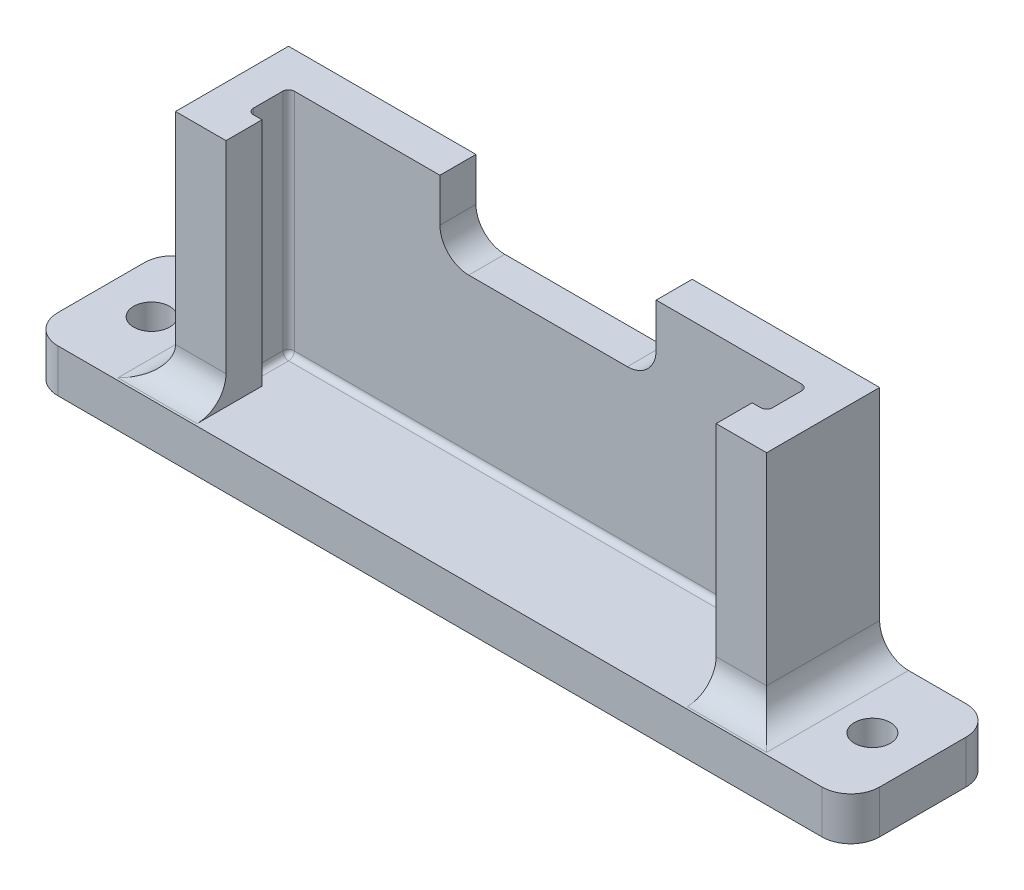
from build123d import *

# Parameters (mm, degrees)
BOSS_EXTRUDE1_DEPTH = 10.16
SKETCH3_W           = 19.05
SKETCH3_H           = 6.35
CUT_EXTRUDE1_DEPTH  = 19.05
SKETCH4_W           = 72.39
SKETCH4_H           = 12.7
BOSS_EXTRUDE2_DEPTH = 3.81
SKETCH5_R           = 1.5875
CUT_EXTRUDE2_DEPTH  = 43.059163523
FILLET1_R           = 2.54
FILLET2_R           = 0.508
FILLET3_R           = 2.54
FILLET4_R           = 2.54


with BuildPart() as part:
    # Sketch2 → Boss-Extrude1 (new, symmetric)
    with BuildSketch(Plane(origin=(0, 0, 0), x_dir=(1, 0, 0), z_dir=(0, 1, 0))):
        Polygon((22.86, 3.6068), (-22.86, 3.6068), (-22.86, 0), (-21.59, 0), (-21.59, -3.175), (-26.035, -3.175), (-26.035, 6.7818), (26.035, 6.7818), (26.035, -3.175), (21.59, -3.175), (21.59, 0), (22.86, 0), align=None)
    extrude(amount=BOSS_EXTRUDE1_DEPTH, both=True)

    # Sketch3 → Cut-Extrude1 (cut)
    with BuildSketch(Plane.XY.offset(-3.6068)):
        with Locations((0, 6.985)):
            Rectangle(SKETCH3_W, SKETCH3_H)
    extrude(amount=-CUT_EXTRUDE1_DEPTH, mode=Mode.SUBTRACT)

    # Sketch4 → Boss-Extrude2 (add)
    with BuildSketch(Plane.XZ.offset(10.16)):
        with Locations((0, -0.4318)):
            Rectangle(SKETCH4_W, SKETCH4_H)
    extrude(amount=BOSS_EXTRUDE2_DEPTH)

    # Sketch5 → Cut-Extrude2 (cut, through all)
    with BuildSketch(Plane(origin=(0, -10.16, 0), x_dir=(1, 0, 0), z_dir=(0, 1, 0))):
        with Locations(Location((-31.75, 0.4318, 0), (0, 0, 270))):
            Circle(SKETCH5_R)
        with Locations(Location((31.75, 0.4318, 0), (0, 0, 90))):
            Circle(SKETCH5_R)
    extrude(amount=-CUT_EXTRUDE2_DEPTH, mode=Mode.SUBTRACT)

    # Fillet1
    fillet1_edges = [part.edges().sort_by_distance(p)[0] for p in [
        (-23.8125, -10.16, 3.175),
        (-26.035, -10.16, -1.8034),
        (26.035, -10.16, -1.8034),
        (23.8125, -10.16, 3.175),
    ]]
    fillet(fillet1_edges, radius=FILLET1_R)

    # Fillet2
    fillet2_edges = [part.edges().sort_by_distance(p)[0] for p in [
        (0, -10.16, -3.6068),
        (-22.86, -10.16, -1.8034),
        (-22.86, 0, 0),
        (22.86, 0, 0),
        (22.86, 0, -3.6068),
        (-22.86, 0, -3.6068),
    ]]
    fillet(fillet2_edges, radius=FILLET2_R)

    # Fillet3
    fillet3_edges = [part.edges().sort_by_distance(p)[0] for p in [
        (9.525, 3.81, -5.1943),
        (-9.525, 3.81, -5.1943),
    ]]
    fillet(fillet3_edges, radius=FILLET3_R)

    # Fillet4
    fillet4_edges = [part.edges().sort_by_distance(p)[0] for p in [
        (-36.195, -12.065, 5.9182),
        (-36.195, -12.065, -6.7818),
        (36.195, -12.065, -6.7818),
        (36.195, -12.065, 5.9182),
    ]]
    fillet(fillet4_edges, radius=FILLET4_R)


solid = part.part
